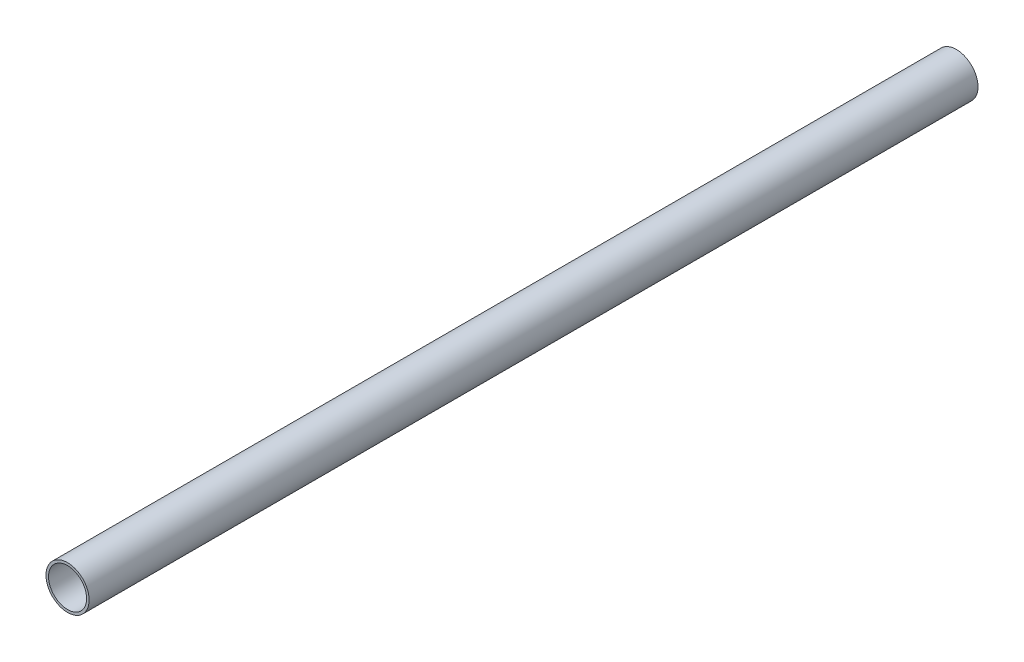
from build123d import *

# Parameters (mm, degrees)
SKETCH1_R           = 17
SKETCH1_R_2         = 15
BOSS_EXTRUDE1_DEPTH = 700


with BuildPart() as part:
    # Sketch1 → Boss-Extrude1 (new body)
    with BuildSketch(Plane.XY):
        Circle(SKETCH1_R)
        Circle(SKETCH1_R_2, mode=Mode.SUBTRACT)
    extrude(amount=BOSS_EXTRUDE1_DEPTH)


solid = part.part
